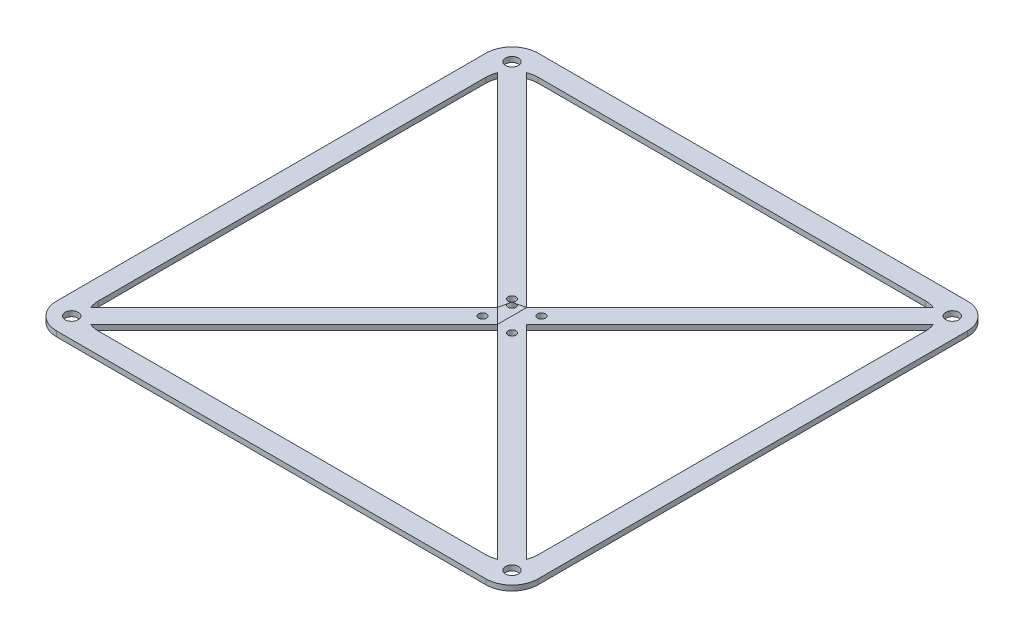
from build123d import *

# Parameters (mm, degrees)
SKETCH1_W           = 185
SKETCH1_H           = 185
SKETCH1_R           = 1.5
BOSS_EXTRUDE1_DEPTH = 2
CUT_EXTRUDE1_DEPTH  = 2
FILLET1_R           = 10
SKETCH3_R           = 2.5
CUT_EXTRUDE2_DEPTH  = 262.637153325


with BuildPart() as part:
    # Sketch1 → Boss-Extrude1 (new body)
    with BuildSketch(Plane(origin=(0, 0, 0), x_dir=(1, 0, 0), z_dir=(0, 1, 0))):
        with Locations((92.5, 92.5)):
            Rectangle(SKETCH1_W, SKETCH1_H)
        with Locations(Location((86.843145751, 98.156854249, 0), (0, 0, 270))):
            Circle(SKETCH1_R, mode=Mode.SUBTRACT)
        with Locations(Location((98.156854249, 98.156854249, 0), (0, 0, 270))):
            Circle(SKETCH1_R, mode=Mode.SUBTRACT)
        with Locations(Location((98.156854249, 86.843145751, 0), (0, 0, 270))):
            Circle(SKETCH1_R, mode=Mode.SUBTRACT)
        with Locations(Location((86.843145751, 86.843145751, 0), (0, 0, 270))):
            Circle(SKETCH1_R, mode=Mode.SUBTRACT)
    extrude(amount=BOSS_EXTRUDE1_DEPTH)

    # Sketch2 → Cut-Extrude1 (cut)
    with BuildSketch(Plane(origin=(0, 2, 0), x_dir=(1, 0, 0), z_dir=(0, 1, 0))):
        with BuildLine():
            ThreePointArc((18, 177), (16.141462703, 176.825774225), (14.347686426, 176.309167823))
            Line((14.347686426, 176.309167823), (92.5, 98.156854249))
            Line((92.5, 98.156854249), (170.652313574, 176.309167823))
            ThreePointArc((170.652313574, 176.309167823), (168.858537297, 176.825774225), (167, 177))
            Line((167, 177), (18, 177))
        make_face()
        with BuildLine():
            Line((86.843145751, 92.5), (8.690832177, 170.652313574))
            ThreePointArc((8.690832177, 170.652313574), (8.174225583, 168.858536282), (8, 166.999997934))
            Line((8, 166.999997934), (8, 18))
            ThreePointArc((8, 18), (8.174225775, 16.141462703), (8.690832177, 14.347686426))
            Line((8.690832177, 14.347686426), (86.843145751, 92.5))
        make_face()
        with BuildLine():
            Line((170.652313574, 8.690832177), (92.5, 86.843145751))
            Line((92.5, 86.843145751), (14.347686426, 8.690832177))
            ThreePointArc((14.347686426, 8.690832177), (16.141462703, 8.174225775), (18, 8))
            Line((18, 8), (167, 8))
            ThreePointArc((167, 8), (168.858537297, 8.174225775), (170.652313574, 8.690832177))
        make_face()
        with BuildLine():
            Line((176.309167823, 170.652313574), (98.156854249, 92.5))
            Line((98.156854249, 92.5), (176.309167823, 14.347686426))
            ThreePointArc((176.309167823, 14.347686426), (176.825774033, 16.141461688), (177, 17.999997934))
            Line((177, 17.999997934), (177, 167))
            ThreePointArc((177, 167), (176.825774225, 168.858537297), (176.309167823, 170.652313574))
        make_face()
    extrude(amount=-CUT_EXTRUDE1_DEPTH, mode=Mode.SUBTRACT)

    # Fillet1
    fillet1_edges = [part.edges().sort_by_distance(p)[0] for p in [
        (0, 1, -185),
        (185, 1, -185),
        (185, 1, 0),
        (0, 1, 0),
    ]]
    fillet(fillet1_edges, radius=FILLET1_R)

    # Sketch3 → Cut-Extrude2 (cut, through all)
    with BuildSketch(Plane(origin=(0, 2, 0), x_dir=(1, 0, 0), z_dir=(0, 1, 0))):
        with Locations(Location((7.878679656, 177.121320344, 0), (0, 0, 270))):
            Circle(SKETCH3_R)
        with Locations(Location((177.121320344, 177.121320344, 0), (0, 0, 270))):
            Circle(SKETCH3_R)
        with Locations(Location((177.121320344, 7.878679656, 0), (0, 0, 270))):
            Circle(SKETCH3_R)
        with Locations(Location((7.878679656, 7.878679656, 0), (0, 0, 270))):
            Circle(SKETCH3_R)
    extrude(amount=-CUT_EXTRUDE2_DEPTH, mode=Mode.SUBTRACT)


solid = part.part
